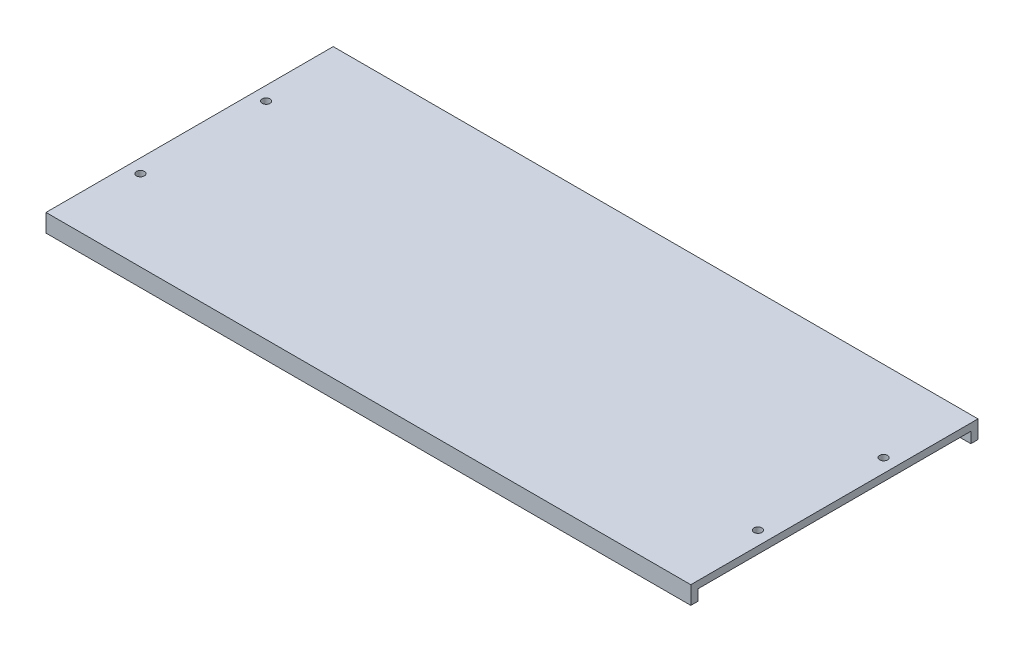
from build123d import *

# Parameters (mm, degrees)
SKETCH_1_W      = 179.6
SKETCH_1_H      = 76
SKETCH_1_R      = 1.1
EXTRUDE_1_DEPTH = 2
SKETCH_2_W      = 179.6
SKETCH_2_H      = 2
EXTRUDE_2_DEPTH = 5


with BuildPart() as part:
    # 草图1 → 凸台-拉伸1 (new body)
    with BuildSketch(Plane(origin=(0, 0, 0), x_dir=(1, 0, 0), z_dir=(0, 1, 0))):
        Rectangle(SKETCH_1_W, SKETCH_1_H)
        with Locations(Location((-86, 17.5, 0), (0, 0, 270))):
            Circle(SKETCH_1_R, mode=Mode.SUBTRACT)
        with Locations(Location((-86, -17.5, 0), (0, 0, 90))):
            Circle(SKETCH_1_R, mode=Mode.SUBTRACT)
        with Locations(Location((86, -17.5, 0), (0, 0, 270))):
            Circle(SKETCH_1_R, mode=Mode.SUBTRACT)
        with Locations(Location((86, 17.5, 0), (0, 0, 90))):
            Circle(SKETCH_1_R, mode=Mode.SUBTRACT)
    extrude(amount=EXTRUDE_1_DEPTH)

    # 草图2 → 凸台-拉伸2 (add)
    with BuildSketch(Plane(origin=(0, 2, 0), x_dir=(1, 0, 0), z_dir=(0, 1, 0))):
        with Locations((0, 39)):
            Rectangle(SKETCH_2_W, SKETCH_2_H)
        with Locations((0, -39)):
            Rectangle(SKETCH_2_W, SKETCH_2_H)
    extrude(amount=-EXTRUDE_2_DEPTH)


solid = part.part
